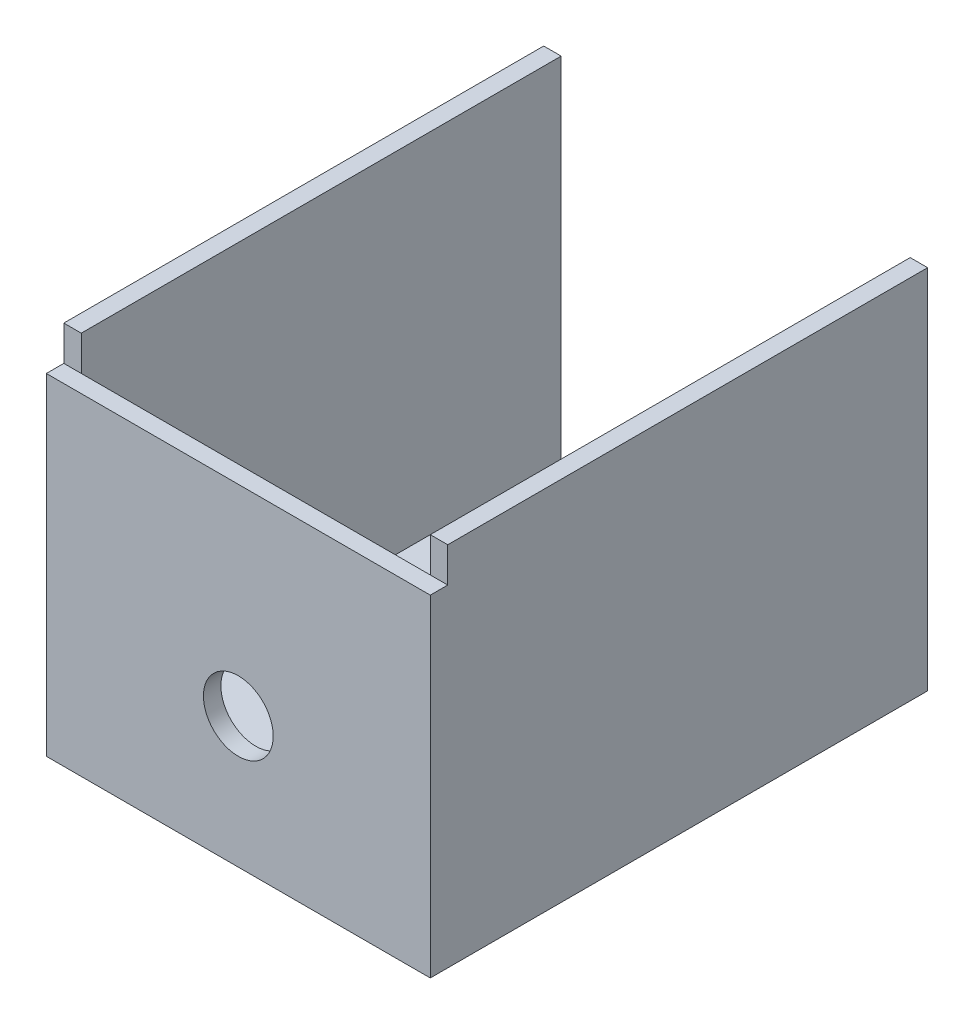
from build123d import *

# Parameters (mm, degrees)
BOSS_EXTRUDE1_DEPTH     = 55
SKETCH2_W               = 44
SKETCH2_H               = 38
BOSS_EXTRUDE2_DEPTH     = 2
CUT_EXTRUDE1_DEPTH      = 84.360662185
CUT_EXTRUDE1_DEPTH_BACK = 84.360662185
SKETCH3_R               = 4


with BuildPart() as part:
    # Sketch1 → Boss-Extrude1 (new body)
    with BuildSketch(Plane.XY):
        Polygon((0, 0), (0, -42), (-44, -42), (-44, 0), (-42, 0), (-42, -40), (-2, -40), (-2, 0), align=None)
    extrude(amount=BOSS_EXTRUDE1_DEPTH)

    # Sketch2 → Boss-Extrude2 (add)
    with BuildSketch(Plane.XY.offset(55)):
        with Locations((-22, -23)):
            Rectangle(SKETCH2_W, SKETCH2_H)
    extrude(amount=BOSS_EXTRUDE2_DEPTH)

    # Sketch3 → Cut-Extrude1 (cut, two sides: drawn at the far end of the back side and taken through both)
    with BuildSketch(Plane.XY.offset(57).offset(-CUT_EXTRUDE1_DEPTH_BACK)):
        with Locations((-22, -27)):
            Circle(SKETCH3_R)
    extrude(amount=CUT_EXTRUDE1_DEPTH + CUT_EXTRUDE1_DEPTH_BACK, mode=Mode.SUBTRACT)


solid = part.part
